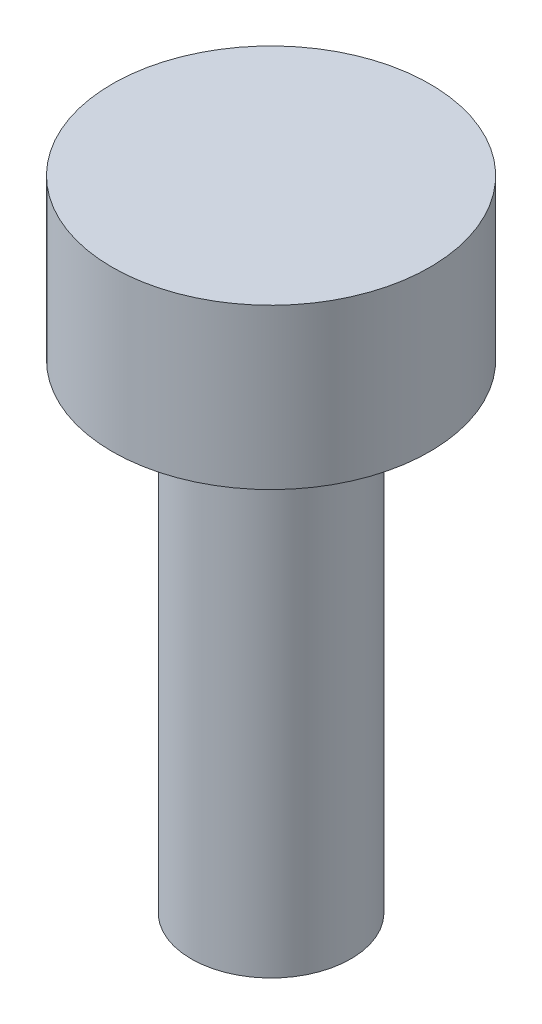
from build123d import *

# Parameters (mm, degrees)
M2X6_FULL_THREAD_ENVELOPE_SKETCH_R     = 1
M2X6_FULL_THREAD_ENVELOPE_DEPTH        = 6
PURCHASED_DIN912_MAXIMUM_HEAD_SKETCH_R = 1.99
PURCHASED_DIN912_MAXIMUM_HEAD_DEPTH    = 2


with BuildPart() as part:
    # M2x6 full-thread envelope sketch → M2x6 full-thread envelope (new body)
    with BuildSketch(Plane(origin=(0, -73, 0), x_dir=(1, 0, 0), z_dir=(0, 1, 0))):
        with Locations(Location((-26.291651246, 8.5, 0), (0, 0, 270))):
            Circle(M2X6_FULL_THREAD_ENVELOPE_SKETCH_R)
    extrude(amount=M2X6_FULL_THREAD_ENVELOPE_DEPTH)

    # Purchased DIN912 maximum head sketch → Purchased DIN912 maximum head (add)
    with BuildSketch(Plane(origin=(0, -75, 0), x_dir=(1, 0, 0), z_dir=(0, 1, 0))):
        with Locations(Location((-26.291651246, 8.5, 0), (0, 0, 270))):
            Circle(PURCHASED_DIN912_MAXIMUM_HEAD_SKETCH_R)
    extrude(amount=PURCHASED_DIN912_MAXIMUM_HEAD_DEPTH)


with BuildPart() as body_2:
    # Mirror1: mirrored copy
    add(part.part.mirror(Plane(origin=(0, 0, 0), x_dir=(0, 0, 1), z_dir=(0, -1, 0))))


solid = body_2.part
